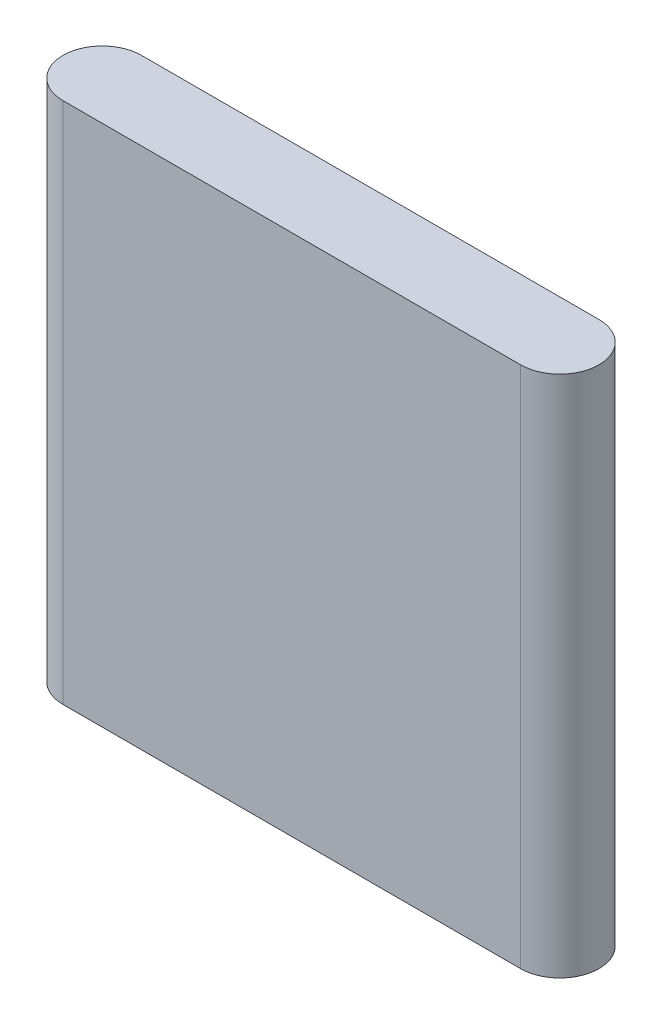
from build123d import *

# Parameters (mm, degrees)
EXTRUDE_1_DEPTH = 20


with BuildPart() as part:
    # 草图1 → 凸台-拉伸1 (new, symmetric)
    with BuildSketch(Plane(origin=(0, 0, 0), x_dir=(1, 0, 0), z_dir=(0, 1, 0))):
        with BuildLine():
            Line((-17.5, 3), (17.5, 3))
            ThreePointArc((17.5, 3), (20.5, 0), (17.5, -3))
            Line((17.5, -3), (-17.5, -3))
            ThreePointArc((-17.5, -3), (-20.5, 0), (-17.5, 3))
        make_face()
    extrude(amount=EXTRUDE_1_DEPTH, both=True)


solid = part.part
